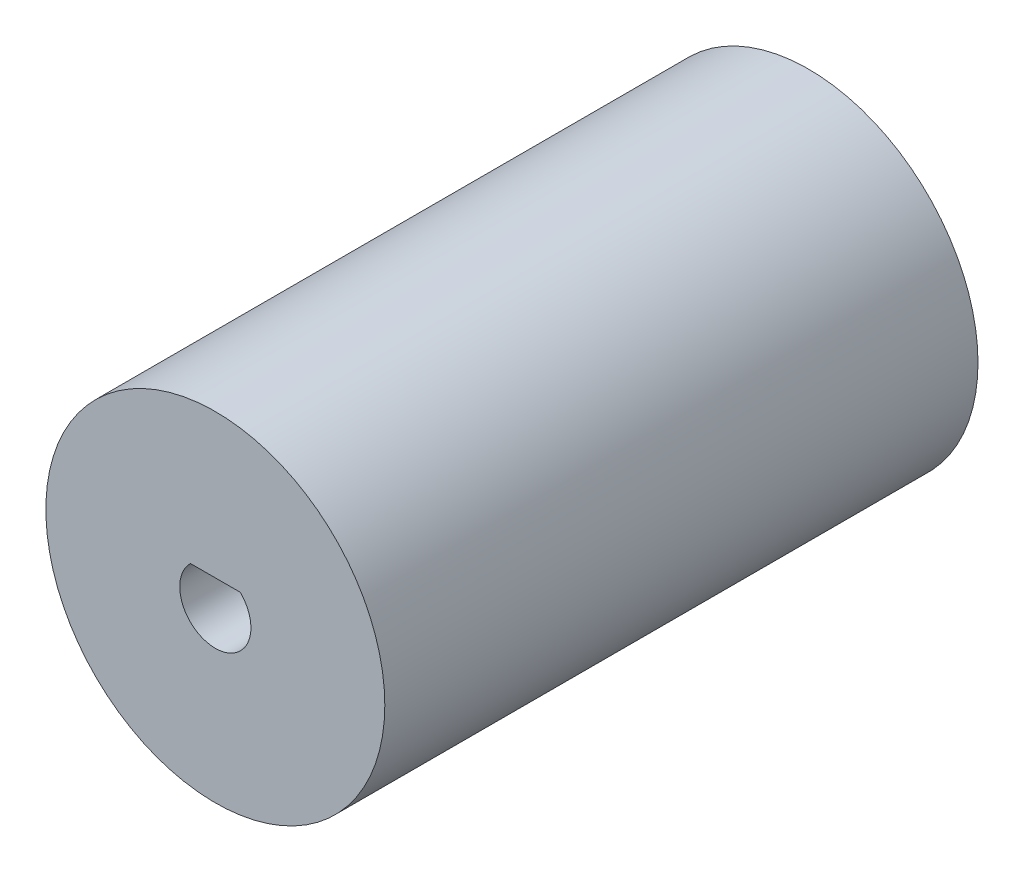
from build123d import *

# Parameters (mm, degrees)
ESQUISSE1_R             = 10
BOSS_EXTRU_1_DEPTH      = 35
ESQUISSE1_3_R           = 6.05
ENL_V_MAT_EXTRU_1_DEPTH = 25
ENL_V_MAT_EXTRU_2_DEPTH = 9


with BuildPart() as part:
    # Esquisse1 → Boss.-Extru.1 (new body)
    with BuildSketch(Plane.XY):
        Circle(ESQUISSE1_R)
    extrude(amount=BOSS_EXTRU_1_DEPTH)

    # Esquisse1<3> → Enlèv. mat.-Extru.1 (cut)
    with BuildSketch(Plane.XY):
        Circle(ESQUISSE1_3_R)
    extrude(amount=ENL_V_MAT_EXTRU_1_DEPTH, mode=Mode.SUBTRACT)

    # Esquisse2 → Enlèv. mat.-Extru.2 (cut)
    with BuildSketch(Plane.XY.offset(35)):
        with BuildLine():
            Line((-1.469693846, 1.5), (1.469693846, 1.5))
            ThreePointArc((1.469693846, 1.5), (0, -2.1), (-1.469693846, 1.5))
        make_face()
    extrude(amount=-ENL_V_MAT_EXTRU_2_DEPTH, mode=Mode.SUBTRACT)


solid = part.part
